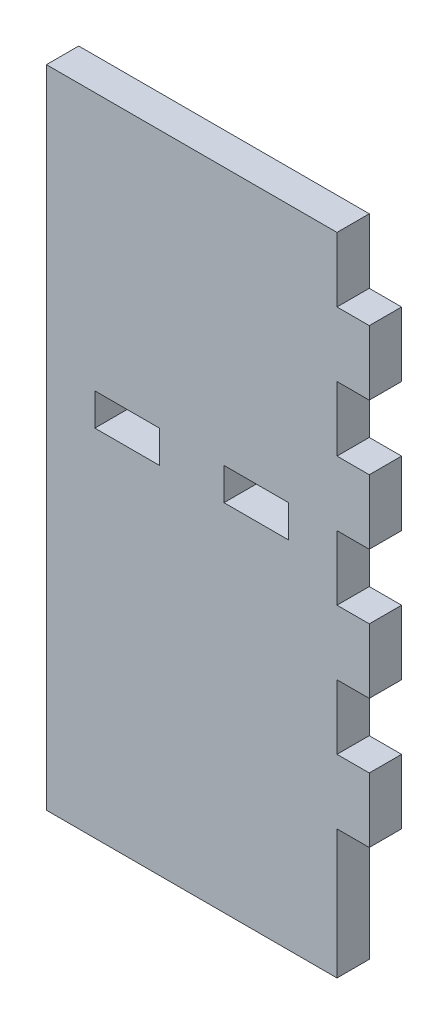
from build123d import *

# Parameters (mm, degrees)
ESQUISSE1_W                     = 57.15
ESQUISSE1_H                     = 127
BOSS_EXTRU_1_DEPTH              = 6.35
ESQUISSE2_W                     = 6.35
ESQUISSE2_H                     = 12.7
BOSS_EXTRU_2_DEPTH              = 6.35
R_P_TITION_LIN_AIRE1_COUNT      = 4
R_P_TITION_LIN_AIRE1_PITCH      = 25.4
ESQUISSE3_W                     = 12.7
ESQUISSE3_H                     = 6.35
ENL_V_MAT_EXTRU_1_DEPTH         = 6.35
R_P_TITION_LIN_AIRE2_COUNT      = 2
R_P_TITION_LIN_AIRE2_PITCH      = 25.4
R_P_TITION_LIN_AIRE2_COUNT_DIR2 = 2
R_P_TITION_LIN_AIRE2_PITCH_DIR2 = 57.15


with BuildPart() as part:
    # Esquisse1 → Boss.-Extru.1 (new body)
    with BuildSketch(Plane.XY):
        Rectangle(ESQUISSE1_W, ESQUISSE1_H)
    extrude(amount=BOSS_EXTRU_1_DEPTH)

    # Esquisse2 → Boss.-Extru.2 (add)
    with BuildSketch(Plane.XY.offset(6.35)):
        with Locations((31.75, 44.45)):
            Rectangle(ESQUISSE2_W, ESQUISSE2_H)
    boss_extru_2 = extrude(amount=-BOSS_EXTRU_2_DEPTH)

    # Répétition linéaire1: Boss.-Extru.2 ×4
    with Locations(*[(0, -i * R_P_TITION_LIN_AIRE1_PITCH, 0) for i in range(1, R_P_TITION_LIN_AIRE1_COUNT)]):
        add(boss_extru_2)

    # Esquisse3 → Enlèv. mat.-Extru.1 (cut)
    with BuildSketch(Plane.XY.offset(6.35)):
        with Locations((-12.7, 9.525)):
            Rectangle(ESQUISSE3_W, ESQUISSE3_H)
    enl_v_mat_extru_1 = extrude(amount=-ENL_V_MAT_EXTRU_1_DEPTH, mode=Mode.SUBTRACT)

    # Répétition linéaire2: Enl_v. mat.-Extru.1 2 × 2
    with Locations(*[(i * R_P_TITION_LIN_AIRE2_PITCH, j * R_P_TITION_LIN_AIRE2_PITCH_DIR2, 0) for i in range(R_P_TITION_LIN_AIRE2_COUNT) for j in range(R_P_TITION_LIN_AIRE2_COUNT_DIR2) if (i, j) != (0, 0)]):
        add(enl_v_mat_extru_1, mode=Mode.SUBTRACT)


solid = part.part
